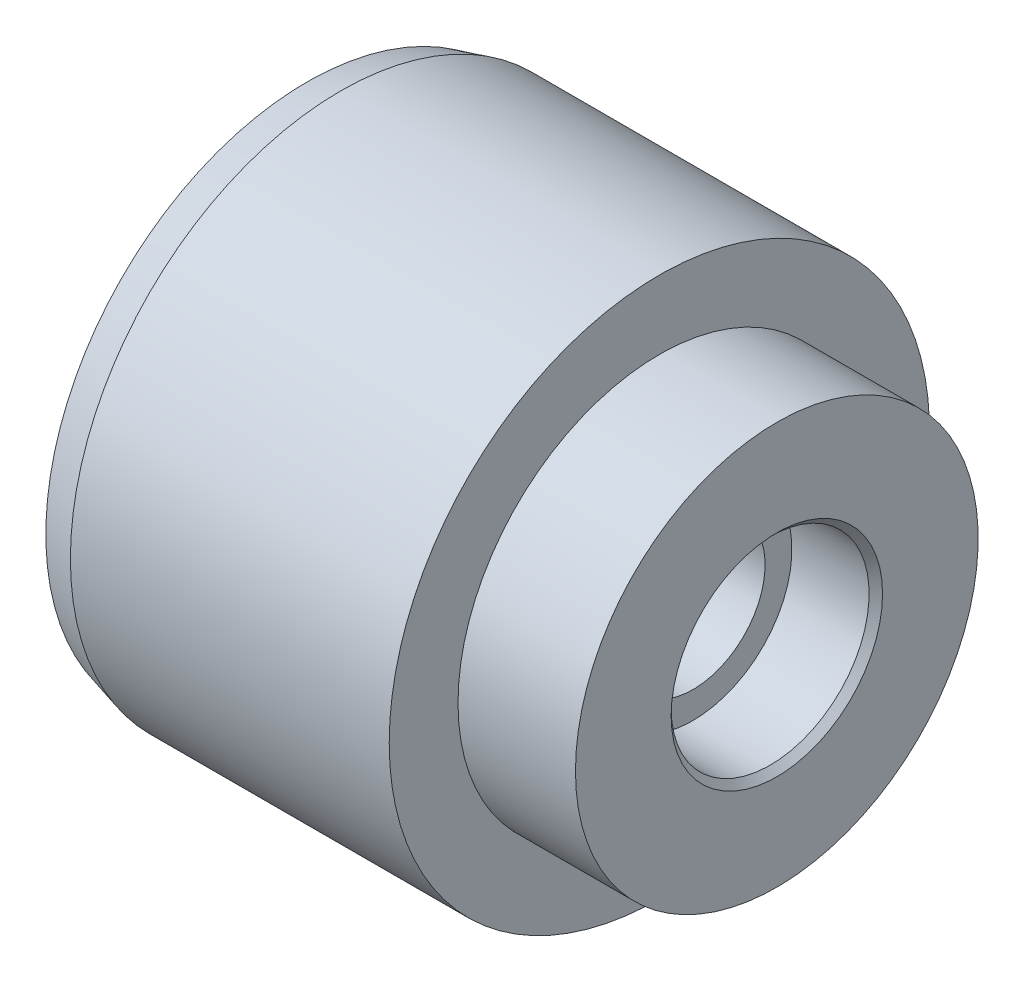
from build123d import *

# Parameters (mm, degrees)
CHAMFER_1_SIZE  = 1
CHAMFER_1_SIZE2 = 0.267949192
CHAMFER_2_SIZE  = 0.2
HOLE_WIZARD_1_D = 4.3


with BuildPart() as part:
    # Эскиз1 → Повернуть1 (revolve)
    with BuildSketch(Plane.XY, mode=Mode.PRIVATE) as revolve_1_sk:
        Polygon((14, 2.95), (11.5, 2.95), (11.5, 0), (0, 0), (0, 8.05), (10.5, 8.05), (10.5, 6), (14, 6), align=None)
    revolve(revolve_1_sk.sketch.rotate(Axis((-5.881924198, 0, 0), (1, 0, 0)), 90), axis=Axis((-5.881924198, 0, 0), (1, 0, 0)))

    # Фаска1
    chamfer_1_edges = [part.edges().sort_by_distance(p)[0] for p in [
        (0, 0, -8.05),
    ]]
    chamfer_1_side = [part.faces().sort_by_distance(p)[0] for p in [
        (5.25, 0, -8.05),
    ]]
    chamfer(chamfer_1_edges, length=CHAMFER_1_SIZE, length2=CHAMFER_1_SIZE2, reference=chamfer_1_side[0])

    # Фаска2
    chamfer_2_edges = [part.edges().sort_by_distance(p)[0] for p in [
        (14, 0, -2.95),
    ]]
    chamfer(chamfer_2_edges, length=CHAMFER_2_SIZE)

    # Отверстие с зазором 1 (through all)
    with Locations(Plane.ZY):
        with Locations((0, 0)):
            Hole(HOLE_WIZARD_1_D / 2)


solid = part.part
